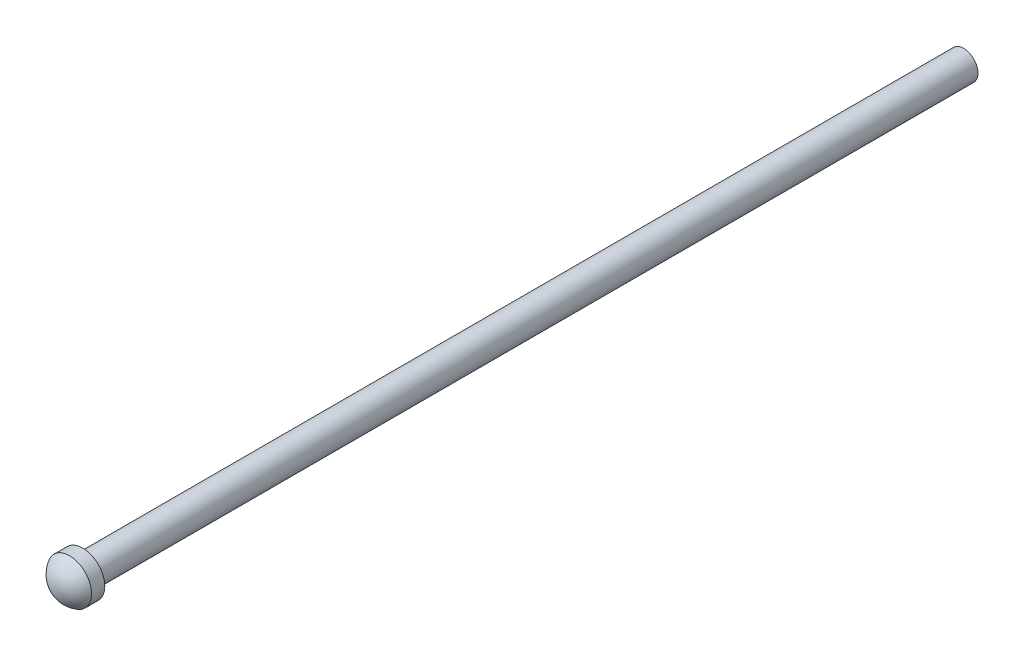
from build123d import *

# Parameters (mm, degrees)
SKETCH2_R           = 3.25
SKETCH8_R           = 5
BOSS_EXTRUDE1_DEPTH = 3
DOME1_FACE_RADIUS   = 5
DOME1_HEIGHT        = 3


with BuildPart() as part:
    # Sweep1: sweep along a path in Sketch7
    with BuildLine(Plane(origin=(0, 0, 0), x_dir=(0, 0, -1), z_dir=(1, 0, 0))) as sweep1_path:
        Line((0, 0), (200, 0))
    # Sketch2 → Sweep1 (sweep)
    with BuildSketch(Plane.XY):
        with Locations((5, 60)):
            Circle(SKETCH2_R)
    sweep(path=sweep1_path.line)

    # Sketch8 → Boss-Extrude1 (add)
    with BuildSketch(Plane.XY):
        with Locations((5, 60)):
            Circle(SKETCH8_R)
    extrude(amount=BOSS_EXTRUDE1_DEPTH)

    # Dome1: a dome of height H over a round flat face of radius A is a cap of a sphere of radius (A * A + H * H) / (2 * H)
    dome1_r = (DOME1_FACE_RADIUS * DOME1_FACE_RADIUS + DOME1_HEIGHT * DOME1_HEIGHT) / (2 * DOME1_HEIGHT)
    dome1_base = Plane((5, 60, 3), z_dir=(0, 0, 1))
    with Locations(dome1_base.offset(DOME1_HEIGHT - dome1_r)):
        dome1_ball = Sphere(dome1_r, mode=Mode.PRIVATE)
    add(split(dome1_ball, bisect_by=dome1_base, keep=Keep.TOP, mode=Mode.PRIVATE))


solid = part.part
